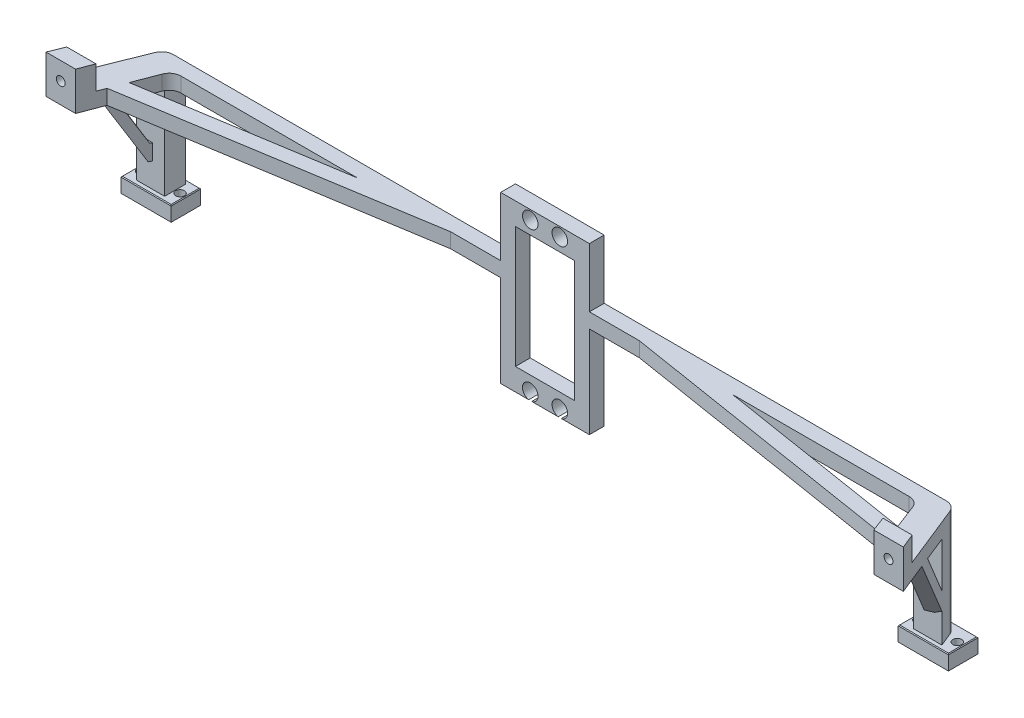
from build123d import *

# Parameters (mm, degrees)
ESQUISSE1_W             = 30
ESQUISSE1_H             = 51
ESQUISSE1_W_2           = 20
ESQUISSE1_H_2           = 41
BOSS_EXTRU_1_DEPTH      = 5
BOSS_EXTRU_3_DEPTH      = 5
BOSS_EXTRU_4_DEPTH      = 8
ESQUISSE5_W             = 30
ESQUISSE5_H             = 5
BOSS_EXTRU_5_DEPTH      = 2.5
ESQUISSE6_W             = 30
ESQUISSE6_H             = 5
BOSS_EXTRU_6_DEPTH      = 2.5
ESQUISSE7_R             = 1.5
ENL_V_MAT_EXTRU_1_DEPTH = 150.584223767
ESQUISSE8_R             = 2.625
ENL_V_MAT_EXTRU_2_DEPTH = 150.584223767
BOSS_EXTRU_8_DEPTH      = 5
BOSS_EXTRU_9_DEPTH      = 31
BOSS_EXTRU_11_DEPTH     = 5
ESQUISSE16_W            = 17
ESQUISSE16_H            = 10
ESQUISSE16_R            = 1.5
BOSS_EXTRU_12_DEPTH     = 5
CHANFREIN3_SIZE         = 0.25
BOSS_EXTRU_13_DEPTH     = 5
BOSS_EXTRU_14_DEPTH     = 5


with BuildPart() as part:
    # Esquisse1 → Boss.-Extru.1 (new body)
    with BuildSketch(Plane.XY):
        Rectangle(ESQUISSE1_W, ESQUISSE1_H)
        Rectangle(ESQUISSE1_W_2, ESQUISSE1_H_2, mode=Mode.SUBTRACT)
    extrude(amount=BOSS_EXTRU_1_DEPTH)

    # Esquisse3 → Boss.-Extru.3 (add)
    with BuildSketch(Plane(origin=(0, 8, 0), x_dir=(1, 0, 0), z_dir=(0, 1, 0))):
        with BuildLine():
            Line((130.711195077, 0), (15, 0))
            Line((15, 0), (15, -5))
            Line((15, -5), (123.166385806, -5))
            ThreePointArc((123.166385806, -5), (125.435495458, -5.705892931), (126.903730879, -7.574429307))
            Line((126.903730879, -7.574429307), (135, -28.8))
            Line((135, -28.8), (145, -28.8))
            Line((145, -28.8), (134.422141223, -2.507057034))
            ThreePointArc((134.422141223, -2.507057034), (132.950416832, -0.685503668), (130.711195077, 0))
        make_face()
        with BuildLine():
            Line((-123.166385806, -5), (-15, -5))
            Line((-15, -5), (-15, 0))
            Line((-15, 0), (-130.711195077, 0))
            ThreePointArc((-130.711195077, 0), (-132.950416832, -0.685503668), (-134.422141223, -2.507057034))
            Line((-134.422141223, -2.507057034), (-145, -28.8))
            Line((-145, -28.8), (-135, -28.8))
            Line((-135, -28.8), (-126.903730879, -7.574429307))
            ThreePointArc((-126.903730879, -7.574429307), (-125.435495458, -5.705892931), (-123.166385806, -5))
        make_face()
    extrude(amount=-BOSS_EXTRU_3_DEPTH)

    # Esquisse4 → Boss.-Extru.4 (add)
    with BuildSketch(Plane(origin=(0, 8, 0), x_dir=(-1, 0, 0), z_dir=(0, 1, 0))):
        Polygon((145, 28.8), (135, 28.8), (133.09280296, 23.8), (142.98846048, 23.8), align=None)
        Polygon((-142.98846048, 23.8), (-145, 28.8), (-135, 28.8), (-133.09280296, 23.8), align=None)
    extrude(amount=BOSS_EXTRU_4_DEPTH)

    # Esquisse5 → Boss.-Extru.5 (add)
    with BuildSketch(Plane(origin=(0, 25.5, 0), x_dir=(1, 0, 0), z_dir=(0, 1, 0))):
        with Locations((0, -2.5)):
            Rectangle(ESQUISSE5_W, ESQUISSE5_H)
    extrude(amount=BOSS_EXTRU_5_DEPTH)

    # Esquisse6 → Boss.-Extru.6 (add)
    with BuildSketch(Plane.XZ.offset(25.5)):
        with Locations((0, 2.5)):
            Rectangle(ESQUISSE6_W, ESQUISSE6_H)
    extrude(amount=BOSS_EXTRU_6_DEPTH)

    # Esquisse7 → Enlèv. mat.-Extru.1 (cut, through all)
    with BuildSketch(Plane(origin=(0, 0, 23.8), x_dir=(-1, 0, 0), z_dir=(0, 0, -1))):
        with Locations((-140, 10)):
            Circle(ESQUISSE7_R)
        with Locations(Location((140, 10, 0), (0, 0, 180))):
            Circle(ESQUISSE7_R)
    extrude(amount=-ENL_V_MAT_EXTRU_1_DEPTH, mode=Mode.SUBTRACT)

    # Esquisse8 → Enlèv. mat.-Extru.2 (cut, through all)
    with BuildSketch(Plane.XY.offset(5)):
        with Locations((-5, 24.925)):
            Circle(ESQUISSE8_R)
        with Locations((5, 24.925)):
            Circle(ESQUISSE8_R)
        with Locations((-5, -25.425)):
            Circle(ESQUISSE8_R)
        with Locations((5, -25.425)):
            Circle(ESQUISSE8_R)
    extrude(amount=-ENL_V_MAT_EXTRU_2_DEPTH, mode=Mode.SUBTRACT)

    # Esquisse12 → Boss.-Extru.8 (add)
    with BuildSketch(Plane(origin=(0, 8, 0), x_dir=(1, 0, 0), z_dir=(0, 1, 0))):
        Polygon((-129.99826692, -15.687214654), (-63.433313414, -5), (-31.892154123, -5), (-132.055900977, -21.081607615), align=None)
        Polygon((132.055900977, -21.081607615), (129.99826692, -15.687214654), (63.433313414, -5), (31.892154123, -5), align=None)
    extrude(amount=-BOSS_EXTRU_8_DEPTH)

    # Esquisse13 → Boss.-Extru.9 (add, through all)
    with BuildSketch(Plane.XZ.offset(-3)):
        with BuildLine():
            Line((-126.684620904, 7), (-136.229687691, 7))
            Line((-136.229687691, 7), (-134.422141223, 2.507057034))
            ThreePointArc((-134.422141223, 2.507057034), (-132.950416832, 0.685503668), (-130.711195077, 0))
            Line((-130.711195077, 0), (-126.684620904, 0))
            Line((-126.684620904, 0), (-126.684620904, 7))
        make_face()
        with BuildLine():
            ThreePointArc((134.422141223, 2.507057034), (132.950416832, 0.685503668), (130.711195077, 0))
            Line((130.711195077, 0), (126.684620904, 0))
            Line((126.684620904, 0), (126.684620904, 7))
            Line((126.684620904, 7), (136.229687691, 7))
            Line((136.229687691, 7), (134.422141223, 2.507057034))
        make_face()
    extrude(amount=BOSS_EXTRU_9_DEPTH)

    # Esquisse15 → Boss.-Extru.11 (add)
    with BuildSketch(Plane(origin=(-114.828371074, 0, -46.196361295), x_dir=(-0.3732357415464263, 0, 0.9277365365405684), z_dir=(-0.9277365365405683, 0, -0.37323574154642625))):
        Polygon((56.042576064, -14.320508076), (66.042576064, 3), (69.506677679, 3), (56.409919429, -19.684250702), align=None)
    boss_extru_11 = extrude(amount=-BOSS_EXTRU_11_DEPTH)

    # Symétrie3: Boss.-Extru.11 across plane
    add(boss_extru_11.mirror(Plane(origin=(0, 0, 0), x_dir=(0, 0, 1), z_dir=(1, 0, 0))))

    # Esquisse16 → Boss.-Extru.12 (add)
    # profile 1 of 2: a face of its own
    with BuildSketch(Plane.XZ.offset(28)):
        with Locations((131.457154298, 3.5)):
            Rectangle(ESQUISSE16_W, ESQUISSE16_H)
        with Locations(Location((124.957154298, 3.5, 0), (0, 0, 270))):
            Circle(ESQUISSE16_R, mode=Mode.SUBTRACT)
        with Locations(Location((137.957154298, 3.5, 0), (0, 0, 90))):
            Circle(ESQUISSE16_R, mode=Mode.SUBTRACT)
    # profile 2 of 2: a face of its own
    with BuildSketch(Plane.XZ.offset(28)):
        with Locations((-131.457154298, 3.5)):
            Rectangle(ESQUISSE16_W, ESQUISSE16_H)
        with Locations(Location((-137.957154298, 3.5, 0), (0, 0, 270))):
            Circle(ESQUISSE16_R, mode=Mode.SUBTRACT)
        with Locations(Location((-124.957154298, 3.5, 0), (0, 0, 90))):
            Circle(ESQUISSE16_R, mode=Mode.SUBTRACT)
    extrude(amount=BOSS_EXTRU_12_DEPTH)

    # Chanfrein3
    chanfrein3_edges = [part.edges().sort_by_distance(p)[0] for p in [
        (139.957154298, -28, 3.5),
        (131.457154298, -28, 8.5),
        (122.957154298, -28, 3.5),
        (131.457154298, -28, -1.5),
        (-122.957154298, -28, 3.5),
        (-131.457154298, -28, 8.5),
        (-139.957154298, -28, 3.5),
        (-131.457154298, -28, -1.5),
    ]]
    chamfer(chanfrein3_edges, length=CHANFREIN3_SIZE)

    # Esquisse17 → Boss.-Extru.13 (add)
    with BuildSketch(Plane(origin=(-20.455095506, 3.753380181, 50.844378892), x_dir=(-0.9280869704105542, -0.02741363174056612, -0.37135302361627764), z_dir=(0.3723634989551998, -0.06832633838021179, -0.9255684394626872))):
        Polygon((119.373285615, -20.220046325), (122.060546569, -20.146178288), (121.000071898, -14.796991142), (119.225556278, -14.845769429), align=None)
    extrude(amount=BOSS_EXTRU_13_DEPTH)

    # Esquisse18 → Boss.-Extru.14 (add)
    with BuildSketch(Plane(origin=(20.455095506, 3.753380181, 50.844378892), x_dir=(-0.9280869704105542, 0.02741363174056612, 0.37135302361627764), z_dir=(-0.3723634989551998, -0.06832633838021179, -0.9255684394626872))):
        Polygon((-119.225556278, -14.845769429), (-121.000071898, -14.796991142), (-122.060546569, -20.146178288), (-119.373285615, -20.220046325), align=None)
    extrude(amount=BOSS_EXTRU_14_DEPTH)


solid = part.part
